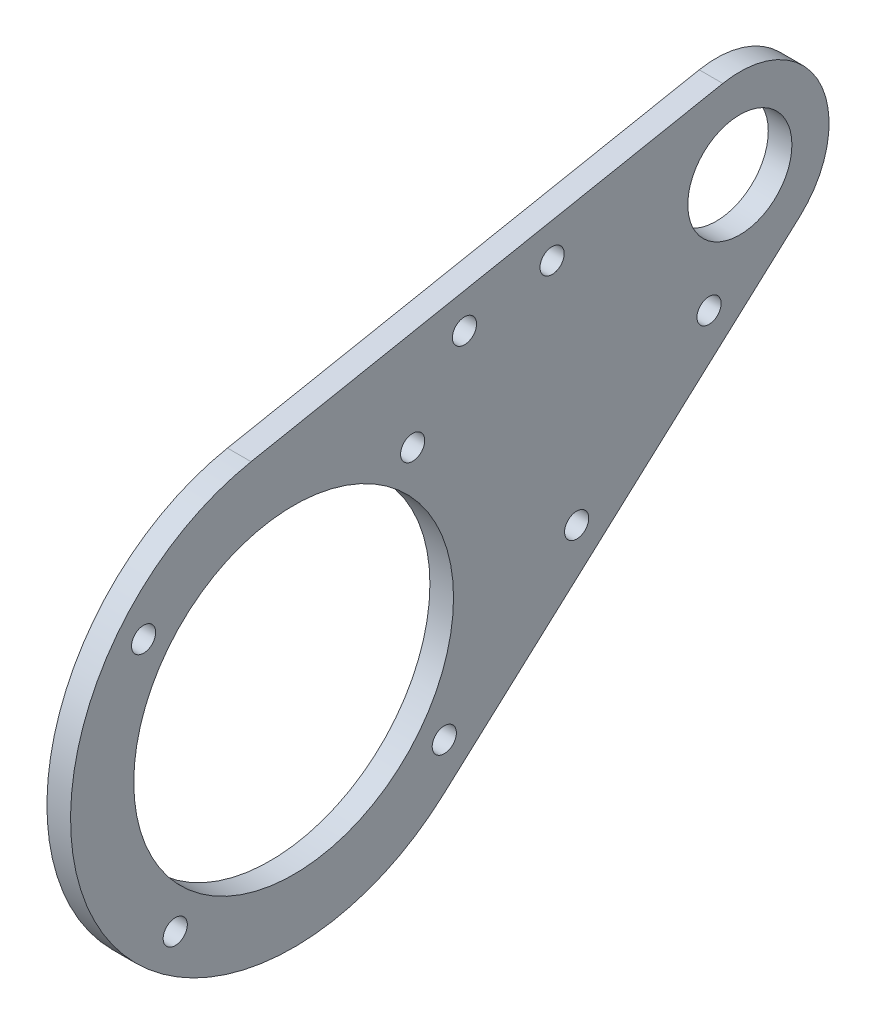
from build123d import *

# Parameters (mm, degrees)
SKETCH1_R           = 21.5
SKETCH1_R_2         = 7
BOSS_EXTRUDE1_DEPTH = 3.175
SKETCH2_R           = 1.625
CUT_EXTRUDE1_DEPTH  = 84.415110292


with BuildPart() as part:
    # Sketch1 → Boss-Extrude1 (new body)
    with BuildSketch(Plane(origin=(0, 0, 0), x_dir=(0, 0, -1), z_dir=(1, 0, 0))):
        with BuildLine():
            Line((-5.724395537, 29.448791074), (57.710241785, 41.77951643))
            ThreePointArc((57.710241785, 41.77951643), (70.733126292, 35.366563146), (68.049758215, 21.10048357))
            Line((68.049758215, 21.10048357), (20.124395537, -22.248791074))
            ThreePointArc((20.124395537, -22.248791074), (-26.83281573, -13.416407865), (-5.724395537, 29.448791074))
        make_face()
        Circle(SKETCH1_R, mode=Mode.SUBTRACT)
        with Locations((60, 30)):
            Circle(SKETCH1_R_2, mode=Mode.SUBTRACT)
    extrude(amount=BOSS_EXTRUDE1_DEPTH)

    # Sketch2 → Cut-Extrude1 (cut, through all)
    with BuildSketch(Plane(origin=(3.175, 0, 0), x_dir=(0, 0, -1), z_dir=(1, 0, 0))):
        with Locations((-20.175789947, 16)):
            Circle(SKETCH2_R)
        with Locations((16.003976299, 20.255101188)):
            Circle(SKETCH2_R)
        with Locations((20.259077487, -15.924665058)):
            Circle(SKETCH2_R)
        with Locations((-15.920688759, -20.179766246)):
            Circle(SKETCH2_R)
        with Locations((38.058110346, 0.174851372)):
            Circle(SKETCH2_R)
        with Locations((55.857143206, 16.274367802)):
            Circle(SKETCH2_R)
        with Locations(Location((22.974747305, 30.341577454, 0), (0, 0, 180))):
            Circle(SKETCH2_R)
        with Locations((34.754263735, 32.631335669)):
            Circle(SKETCH2_R)
    extrude(amount=-CUT_EXTRUDE1_DEPTH, mode=Mode.SUBTRACT)


solid = part.part
